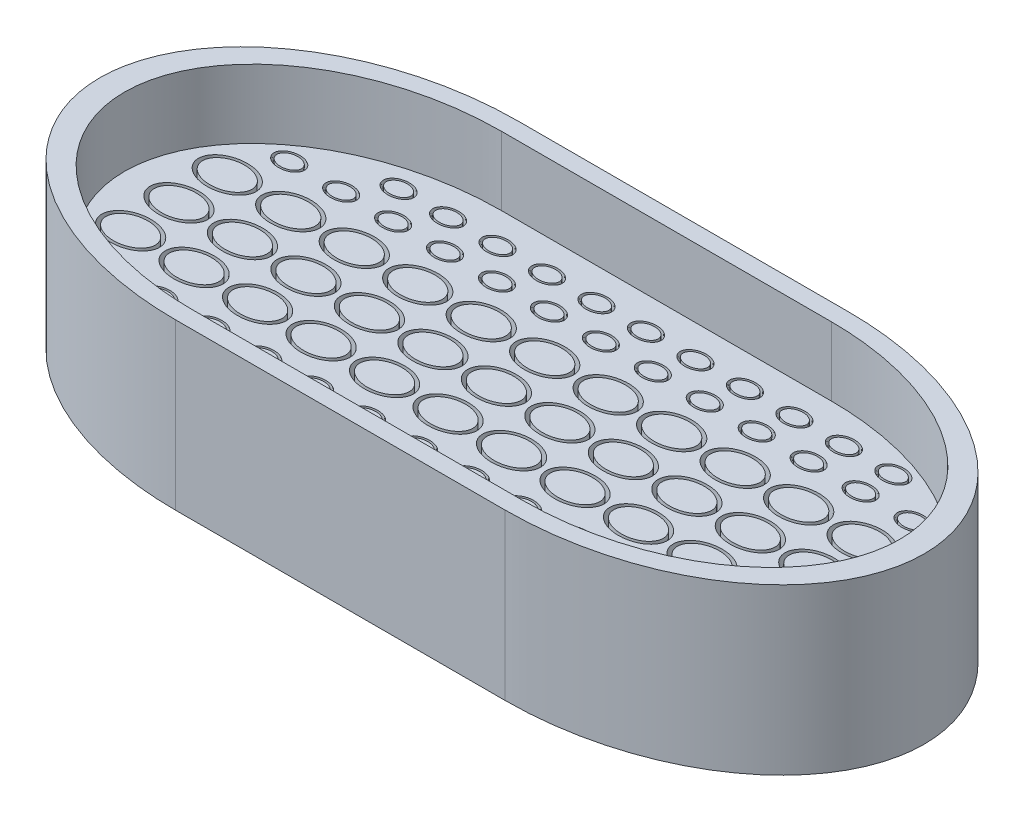
from build123d import *

# Parameters (mm, degrees)
BOSS_EXTRUDE1_DEPTH = 7
BOSS_EXTRUDE2_DEPTH = 12
SKETCH2_R           = 0.925
SKETCH2_R_2         = 0.75
SKETCH2_R_3         = 1.75
SKETCH2_R_4         = 1.5
CUT_EXTRUDE2_DEPTH  = 5
SCALE1_SCALE_X      = 1.2
SCALE1_SCALE_Y      = 1
SCALE1_SCALE_Z      = 0.833


with BuildPart() as part:
    # Sketch1 → Boss-Extrude1 (new body)
    with BuildSketch(Plane(origin=(0, 0, 0), x_dir=(1, 0, 0), z_dir=(0, 1, 0))):
        with BuildLine():
            Line((-10, 13.5), (10, 13.5))
            ThreePointArc((10, 13.5), (23.5, 0), (10, -13.5))
            Line((10, -13.5), (-10, -13.5))
            ThreePointArc((-10, -13.5), (-23.5, 0), (-10, 13.5))
        make_face()
    extrude(amount=BOSS_EXTRUDE1_DEPTH)

    # Sketch1<3> → Boss-Extrude2 (add)
    with BuildSketch(Plane(origin=(0, 0, 0), x_dir=(1, 0, 0), z_dir=(0, 1, 0))):
        with BuildLine():
            Line((-10, -15), (10, -15))
            ThreePointArc((10, -15), (25, 0), (10, 15))
            Line((10, 15), (-10, 15))
            ThreePointArc((-10, 15), (-25, 0), (-10, -15))
        make_face()
        with BuildLine():
            ThreePointArc((-10, 13.5), (-23.5, 0), (-10, -13.5))
            Line((-10, -13.5), (10, -13.5))
            ThreePointArc((10, -13.5), (23.5, 0), (10, 13.5))
            Line((10, 13.5), (-10, 13.5))
        make_face(mode=Mode.SUBTRACT)
    extrude(amount=BOSS_EXTRUDE2_DEPTH)

    # Sketch2 → Cut-Extrude2 (cut)
    # profile 1 of 81: a face of its own
    with BuildSketch(Plane(origin=(0, 7, 0), x_dir=(1, 0, 0), z_dir=(0, 1, 0))):
        with Locations(Location((18.777529996, -7.94251489, 0), (0, 0, 270))):
            Circle(SKETCH2_R)
        with Locations(Location((18.777529996, -7.94251489, 0), (0, 0, 270))):
            Circle(SKETCH2_R_2, mode=Mode.SUBTRACT)
    # profile 2 of 81: a face of its own
    with BuildSketch(Plane(origin=(0, 7, 0), x_dir=(1, 0, 0), z_dir=(0, 1, 0))):
        with Locations(Location((15.627529996, -7.94251489, 0), (0, 0, 270))):
            Circle(SKETCH2_R)
        with Locations(Location((15.627529996, -7.94251489, 0), (0, 0, 270))):
            Circle(SKETCH2_R_2, mode=Mode.SUBTRACT)
    # profile 3 of 81: a face of its own
    with BuildSketch(Plane(origin=(0, 7, 0), x_dir=(1, 0, 0), z_dir=(0, 1, 0))):
        with Locations(Location((18.30425361, -4.221261528, 0), (0, 0, 270))):
            Circle(SKETCH2_R_3)
        with Locations(Location((18.30425361, -4.221261528, 0), (0, 0, 270))):
            Circle(SKETCH2_R_4, mode=Mode.SUBTRACT)
    # profile 4 of 81: a face of its own
    with BuildSketch(Plane(origin=(0, 7, 0), x_dir=(1, 0, 0), z_dir=(0, 1, 0))):
        with Locations(Location((14.45425361, -4.221261528, 0), (0, 0, 270))):
            Circle(SKETCH2_R_3)
        with Locations(Location((14.45425361, -4.221261528, 0), (0, 0, 270))):
            Circle(SKETCH2_R_4, mode=Mode.SUBTRACT)
    # profile 5 of 81: a face of its own
    with BuildSketch(Plane(origin=(0, 7, 0), x_dir=(1, 0, 0), z_dir=(0, 1, 0))):
        with Locations(Location((12.477529996, -7.94251489, 0), (0, 0, 270))):
            Circle(SKETCH2_R)
        with Locations(Location((12.477529996, -7.94251489, 0), (0, 0, 270))):
            Circle(SKETCH2_R_2, mode=Mode.SUBTRACT)
    # profile 6 of 81: a face of its own
    with BuildSketch(Plane(origin=(0, 7, 0), x_dir=(1, 0, 0), z_dir=(0, 1, 0))):
        with Locations(Location((9.327529996, -7.94251489, 0), (0, 0, 270))):
            Circle(SKETCH2_R)
        with Locations(Location((9.327529996, -7.94251489, 0), (0, 0, 270))):
            Circle(SKETCH2_R_2, mode=Mode.SUBTRACT)
    # profile 7 of 81: a face of its own
    with BuildSketch(Plane(origin=(0, 7, 0), x_dir=(1, 0, 0), z_dir=(0, 1, 0))):
        with Locations(Location((10.60425361, -4.221261528, 0), (0, 0, 270))):
            Circle(SKETCH2_R_3)
        with Locations(Location((10.60425361, -4.221261528, 0), (0, 0, 270))):
            Circle(SKETCH2_R_4, mode=Mode.SUBTRACT)
    # profile 8 of 81: a face of its own
    with BuildSketch(Plane(origin=(0, 7, 0), x_dir=(1, 0, 0), z_dir=(0, 1, 0))):
        with Locations(Location((6.75425361, -4.221261528, 0), (0, 0, 270))):
            Circle(SKETCH2_R_3)
        with Locations(Location((6.75425361, -4.221261528, 0), (0, 0, 270))):
            Circle(SKETCH2_R_4, mode=Mode.SUBTRACT)
    # profile 9 of 81: a face of its own
    with BuildSketch(Plane(origin=(0, 7, 0), x_dir=(1, 0, 0), z_dir=(0, 1, 0))):
        with Locations(Location((6.177529996, -7.94251489, 0), (0, 0, 270))):
            Circle(SKETCH2_R)
        with Locations(Location((6.177529996, -7.94251489, 0), (0, 0, 270))):
            Circle(SKETCH2_R_2, mode=Mode.SUBTRACT)
    # profile 10 of 81: a face of its own
    with BuildSketch(Plane(origin=(0, 7, 0), x_dir=(1, 0, 0), z_dir=(0, 1, 0))):
        with Locations(Location((3.027529996, -7.94251489, 0), (0, 0, 270))):
            Circle(SKETCH2_R)
        with Locations(Location((3.027529996, -7.94251489, 0), (0, 0, 270))):
            Circle(SKETCH2_R_2, mode=Mode.SUBTRACT)
    # profile 11 of 81: a face of its own
    with BuildSketch(Plane(origin=(0, 7, 0), x_dir=(1, 0, 0), z_dir=(0, 1, 0))):
        with Locations(Location((2.90425361, -4.221261528, 0), (0, 0, 270))):
            Circle(SKETCH2_R_3)
        with Locations(Location((2.90425361, -4.221261528, 0), (0, 0, 270))):
            Circle(SKETCH2_R_4, mode=Mode.SUBTRACT)
    # profile 12 of 81: a face of its own
    with BuildSketch(Plane(origin=(0, 7, 0), x_dir=(1, 0, 0), z_dir=(0, 1, 0))):
        with Locations(Location((-0.122470004, -7.94251489, 0), (0, 0, 270))):
            Circle(SKETCH2_R)
        with Locations(Location((-0.122470004, -7.94251489, 0), (0, 0, 270))):
            Circle(SKETCH2_R_2, mode=Mode.SUBTRACT)
    # profile 13 of 81: a face of its own
    with BuildSketch(Plane(origin=(0, 7, 0), x_dir=(1, 0, 0), z_dir=(0, 1, 0))):
        with Locations(Location((-0.94574639, -4.221261528, 0), (0, 0, 270))):
            Circle(SKETCH2_R_3)
        with Locations(Location((-0.94574639, -4.221261528, 0), (0, 0, 270))):
            Circle(SKETCH2_R_4, mode=Mode.SUBTRACT)
    # profile 14 of 81: a face of its own
    with BuildSketch(Plane(origin=(0, 7, 0), x_dir=(1, 0, 0), z_dir=(0, 1, 0))):
        with Locations(Location((-3.272470004, -7.94251489, 0), (0, 0, 270))):
            Circle(SKETCH2_R)
        with Locations(Location((-3.272470004, -7.94251489, 0), (0, 0, 270))):
            Circle(SKETCH2_R_2, mode=Mode.SUBTRACT)
    # profile 15 of 81: a face of its own
    with BuildSketch(Plane(origin=(0, 7, 0), x_dir=(1, 0, 0), z_dir=(0, 1, 0))):
        with Locations(Location((-6.422470004, -7.94251489, 0), (0, 0, 270))):
            Circle(SKETCH2_R)
        with Locations(Location((-6.422470004, -7.94251489, 0), (0, 0, 270))):
            Circle(SKETCH2_R_2, mode=Mode.SUBTRACT)
    # profile 16 of 81: a face of its own
    with BuildSketch(Plane(origin=(0, 7, 0), x_dir=(1, 0, 0), z_dir=(0, 1, 0))):
        with Locations(Location((-4.79574639, -4.221261528, 0), (0, 0, 270))):
            Circle(SKETCH2_R_3)
        with Locations(Location((-4.79574639, -4.221261528, 0), (0, 0, 270))):
            Circle(SKETCH2_R_4, mode=Mode.SUBTRACT)
    # profile 17 of 81: a face of its own
    with BuildSketch(Plane(origin=(0, 7, 0), x_dir=(1, 0, 0), z_dir=(0, 1, 0))):
        with Locations(Location((-8.64574639, -4.221261528, 0), (0, 0, 270))):
            Circle(SKETCH2_R_3)
        with Locations(Location((-8.64574639, -4.221261528, 0), (0, 0, 270))):
            Circle(SKETCH2_R_4, mode=Mode.SUBTRACT)
    # profile 18 of 81: a face of its own
    with BuildSketch(Plane(origin=(0, 7, 0), x_dir=(1, 0, 0), z_dir=(0, 1, 0))):
        with Locations(Location((-9.572470004, -7.94251489, 0), (0, 0, 270))):
            Circle(SKETCH2_R)
        with Locations(Location((-9.572470004, -7.94251489, 0), (0, 0, 270))):
            Circle(SKETCH2_R_2, mode=Mode.SUBTRACT)
    # profile 19 of 81: a face of its own
    with BuildSketch(Plane(origin=(0, 7, 0), x_dir=(1, 0, 0), z_dir=(0, 1, 0))):
        with Locations(Location((-12.722470004, -7.94251489, 0), (0, 0, 270))):
            Circle(SKETCH2_R)
        with Locations(Location((-12.722470004, -7.94251489, 0), (0, 0, 270))):
            Circle(SKETCH2_R_2, mode=Mode.SUBTRACT)
    # profile 20 of 81: a face of its own
    with BuildSketch(Plane(origin=(0, 7, 0), x_dir=(1, 0, 0), z_dir=(0, 1, 0))):
        with Locations(Location((-12.49574639, -4.221261528, 0), (0, 0, 270))):
            Circle(SKETCH2_R_3)
        with Locations(Location((-12.49574639, -4.221261528, 0), (0, 0, 270))):
            Circle(SKETCH2_R_4, mode=Mode.SUBTRACT)
    # profile 21 of 81: a face of its own
    with BuildSketch(Plane(origin=(0, 7, 0), x_dir=(1, 0, 0), z_dir=(0, 1, 0))):
        with Locations(Location((-15.872470004, -7.94251489, 0), (0, 0, 270))):
            Circle(SKETCH2_R)
        with Locations(Location((-15.872470004, -7.94251489, 0), (0, 0, 270))):
            Circle(SKETCH2_R_2, mode=Mode.SUBTRACT)
    # profile 22 of 81: a face of its own
    with BuildSketch(Plane(origin=(0, 7, 0), x_dir=(1, 0, 0), z_dir=(0, 1, 0))):
        with Locations(Location((-16.34574639, -4.221261528, 0), (0, 0, 270))):
            Circle(SKETCH2_R_3)
        with Locations(Location((-16.34574639, -4.221261528, 0), (0, 0, 270))):
            Circle(SKETCH2_R_4, mode=Mode.SUBTRACT)
    # profile 23 of 81: a face of its own
    with BuildSketch(Plane(origin=(0, 7, 0), x_dir=(1, 0, 0), z_dir=(0, 1, 0))):
        with Locations(Location((-19.022470004, -7.94251489, 0), (0, 0, 270))):
            Circle(SKETCH2_R)
        with Locations(Location((-19.022470004, -7.94251489, 0), (0, 0, 270))):
            Circle(SKETCH2_R_2, mode=Mode.SUBTRACT)
    # profile 24 of 81: a face of its own
    with BuildSketch(Plane(origin=(0, 7, 0), x_dir=(1, 0, 0), z_dir=(0, 1, 0))):
        with Locations(Location((-20.19574639, -4.221261528, 0), (0, 0, 270))):
            Circle(SKETCH2_R_3)
        with Locations(Location((-20.19574639, -4.221261528, 0), (0, 0, 270))):
            Circle(SKETCH2_R_4, mode=Mode.SUBTRACT)
    # profile 25 of 81: a face of its own
    with BuildSketch(Plane(origin=(0, 7, 0), x_dir=(1, 0, 0), z_dir=(0, 1, 0))):
        with Locations(Location((-20.19574639, 4.221261528, 0), (0, 0, 270))):
            Circle(SKETCH2_R_3)
        with Locations(Location((-20.19574639, 4.221261528, 0), (0, 0, 270))):
            Circle(SKETCH2_R_4, mode=Mode.SUBTRACT)
    # profile 26 of 81: a face of its own
    with BuildSketch(Plane(origin=(0, 7, 0), x_dir=(1, 0, 0), z_dir=(0, 1, 0))):
        with Locations(Location((-16.34574639, 4.221261528, 0), (0, 0, 270))):
            Circle(SKETCH2_R_3)
        with Locations(Location((-16.34574639, 4.221261528, 0), (0, 0, 270))):
            Circle(SKETCH2_R_4, mode=Mode.SUBTRACT)
    # profile 27 of 81: a face of its own
    with BuildSketch(Plane(origin=(0, 7, 0), x_dir=(1, 0, 0), z_dir=(0, 1, 0))):
        with Locations(Location((-12.49574639, 4.221261528, 0), (0, 0, 270))):
            Circle(SKETCH2_R_3)
        with Locations(Location((-12.49574639, 4.221261528, 0), (0, 0, 270))):
            Circle(SKETCH2_R_4, mode=Mode.SUBTRACT)
    # profile 28 of 81: a face of its own
    with BuildSketch(Plane(origin=(0, 7, 0), x_dir=(1, 0, 0), z_dir=(0, 1, 0))):
        with Locations(Location((-8.64574639, 4.221261528, 0), (0, 0, 270))):
            Circle(SKETCH2_R_3)
        with Locations(Location((-8.64574639, 4.221261528, 0), (0, 0, 270))):
            Circle(SKETCH2_R_4, mode=Mode.SUBTRACT)
    # profile 29 of 81: a face of its own
    with BuildSketch(Plane(origin=(0, 7, 0), x_dir=(1, 0, 0), z_dir=(0, 1, 0))):
        with Locations(Location((-4.79574639, 4.221261528, 0), (0, 0, 270))):
            Circle(SKETCH2_R_3)
        with Locations(Location((-4.79574639, 4.221261528, 0), (0, 0, 270))):
            Circle(SKETCH2_R_4, mode=Mode.SUBTRACT)
    # profile 30 of 81: a face of its own
    with BuildSketch(Plane(origin=(0, 7, 0), x_dir=(1, 0, 0), z_dir=(0, 1, 0))):
        with Locations(Location((-0.94574639, 4.221261528, 0), (0, 0, 270))):
            Circle(SKETCH2_R_3)
        with Locations(Location((-0.94574639, 4.221261528, 0), (0, 0, 270))):
            Circle(SKETCH2_R_4, mode=Mode.SUBTRACT)
    # profile 31 of 81: a face of its own
    with BuildSketch(Plane(origin=(0, 7, 0), x_dir=(1, 0, 0), z_dir=(0, 1, 0))):
        with Locations(Location((2.90425361, 4.221261528, 0), (0, 0, 270))):
            Circle(SKETCH2_R_3)
        with Locations(Location((2.90425361, 4.221261528, 0), (0, 0, 270))):
            Circle(SKETCH2_R_4, mode=Mode.SUBTRACT)
    # profile 32 of 81: a face of its own
    with BuildSketch(Plane(origin=(0, 7, 0), x_dir=(1, 0, 0), z_dir=(0, 1, 0))):
        with Locations(Location((6.75425361, 4.221261528, 0), (0, 0, 270))):
            Circle(SKETCH2_R_3)
        with Locations(Location((6.75425361, 4.221261528, 0), (0, 0, 270))):
            Circle(SKETCH2_R_4, mode=Mode.SUBTRACT)
    # profile 33 of 81: a face of its own
    with BuildSketch(Plane(origin=(0, 7, 0), x_dir=(1, 0, 0), z_dir=(0, 1, 0))):
        with Locations(Location((10.60425361, 4.221261528, 0), (0, 0, 270))):
            Circle(SKETCH2_R_3)
        with Locations(Location((10.60425361, 4.221261528, 0), (0, 0, 270))):
            Circle(SKETCH2_R_4, mode=Mode.SUBTRACT)
    # profile 34 of 81: a face of its own
    with BuildSketch(Plane(origin=(0, 7, 0), x_dir=(1, 0, 0), z_dir=(0, 1, 0))):
        with Locations(Location((18.30425361, 4.221261528, 0), (0, 0, 270))):
            Circle(SKETCH2_R_3)
        with Locations(Location((18.30425361, 4.221261528, 0), (0, 0, 270))):
            Circle(SKETCH2_R_4, mode=Mode.SUBTRACT)
    # profile 35 of 81: a face of its own
    with BuildSketch(Plane(origin=(0, 7, 0), x_dir=(1, 0, 0), z_dir=(0, 1, 0))):
        with Locations(Location((14.45425361, 4.221261528, 0), (0, 0, 270))):
            Circle(SKETCH2_R_3)
        with Locations(Location((14.45425361, 4.221261528, 0), (0, 0, 270))):
            Circle(SKETCH2_R_4, mode=Mode.SUBTRACT)
    # profile 36 of 81: a face of its own
    with BuildSketch(Plane(origin=(0, 7, 0), x_dir=(1, 0, 0), z_dir=(0, 1, 0))):
        with Locations(Location((18.777529996, 7.94251489, 0), (0, 0, 270))):
            Circle(SKETCH2_R)
        with Locations(Location((18.777529996, 7.94251489, 0), (0, 0, 270))):
            Circle(SKETCH2_R_2, mode=Mode.SUBTRACT)
    # profile 37 of 81: a face of its own
    with BuildSketch(Plane(origin=(0, 7, 0), x_dir=(1, 0, 0), z_dir=(0, 1, 0))):
        with Locations(Location((15.627529996, 7.94251489, 0), (0, 0, 270))):
            Circle(SKETCH2_R)
        with Locations(Location((15.627529996, 7.94251489, 0), (0, 0, 270))):
            Circle(SKETCH2_R_2, mode=Mode.SUBTRACT)
    # profile 38 of 81: a face of its own
    with BuildSketch(Plane(origin=(0, 7, 0), x_dir=(1, 0, 0), z_dir=(0, 1, 0))):
        with Locations(Location((12.477529996, 7.94251489, 0), (0, 0, 270))):
            Circle(SKETCH2_R)
        with Locations(Location((12.477529996, 7.94251489, 0), (0, 0, 270))):
            Circle(SKETCH2_R_2, mode=Mode.SUBTRACT)
    # profile 39 of 81: a face of its own
    with BuildSketch(Plane(origin=(0, 7, 0), x_dir=(1, 0, 0), z_dir=(0, 1, 0))):
        with Locations(Location((9.327529996, 7.94251489, 0), (0, 0, 270))):
            Circle(SKETCH2_R)
        with Locations(Location((9.327529996, 7.94251489, 0), (0, 0, 270))):
            Circle(SKETCH2_R_2, mode=Mode.SUBTRACT)
    # profile 40 of 81: a face of its own
    with BuildSketch(Plane(origin=(0, 7, 0), x_dir=(1, 0, 0), z_dir=(0, 1, 0))):
        with Locations(Location((6.177529996, 7.94251489, 0), (0, 0, 270))):
            Circle(SKETCH2_R)
        with Locations(Location((6.177529996, 7.94251489, 0), (0, 0, 270))):
            Circle(SKETCH2_R_2, mode=Mode.SUBTRACT)
    # profile 41 of 81: a face of its own
    with BuildSketch(Plane(origin=(0, 7, 0), x_dir=(1, 0, 0), z_dir=(0, 1, 0))):
        with Locations(Location((3.027529996, 7.94251489, 0), (0, 0, 270))):
            Circle(SKETCH2_R)
        with Locations(Location((3.027529996, 7.94251489, 0), (0, 0, 270))):
            Circle(SKETCH2_R_2, mode=Mode.SUBTRACT)
    # profile 42 of 81: a face of its own
    with BuildSketch(Plane(origin=(0, 7, 0), x_dir=(1, 0, 0), z_dir=(0, 1, 0))):
        with Locations(Location((-0.122470004, 7.94251489, 0), (0, 0, 270))):
            Circle(SKETCH2_R)
        with Locations(Location((-0.122470004, 7.94251489, 0), (0, 0, 270))):
            Circle(SKETCH2_R_2, mode=Mode.SUBTRACT)
    # profile 43 of 81: a face of its own
    with BuildSketch(Plane(origin=(0, 7, 0), x_dir=(1, 0, 0), z_dir=(0, 1, 0))):
        with Locations(Location((-3.272470004, 7.94251489, 0), (0, 0, 270))):
            Circle(SKETCH2_R)
        with Locations(Location((-3.272470004, 7.94251489, 0), (0, 0, 270))):
            Circle(SKETCH2_R_2, mode=Mode.SUBTRACT)
    # profile 44 of 81: a face of its own
    with BuildSketch(Plane(origin=(0, 7, 0), x_dir=(1, 0, 0), z_dir=(0, 1, 0))):
        with Locations(Location((-6.422470004, 7.94251489, 0), (0, 0, 270))):
            Circle(SKETCH2_R)
        with Locations(Location((-6.422470004, 7.94251489, 0), (0, 0, 270))):
            Circle(SKETCH2_R_2, mode=Mode.SUBTRACT)
    # profile 45 of 81: a face of its own
    with BuildSketch(Plane(origin=(0, 7, 0), x_dir=(1, 0, 0), z_dir=(0, 1, 0))):
        with Locations(Location((-9.572470004, 7.94251489, 0), (0, 0, 270))):
            Circle(SKETCH2_R)
        with Locations(Location((-9.572470004, 7.94251489, 0), (0, 0, 270))):
            Circle(SKETCH2_R_2, mode=Mode.SUBTRACT)
    # profile 46 of 81: a face of its own
    with BuildSketch(Plane(origin=(0, 7, 0), x_dir=(1, 0, 0), z_dir=(0, 1, 0))):
        with Locations(Location((-12.722470004, 7.94251489, 0), (0, 0, 270))):
            Circle(SKETCH2_R)
        with Locations(Location((-12.722470004, 7.94251489, 0), (0, 0, 270))):
            Circle(SKETCH2_R_2, mode=Mode.SUBTRACT)
    # profile 47 of 81: a face of its own
    with BuildSketch(Plane(origin=(0, 7, 0), x_dir=(1, 0, 0), z_dir=(0, 1, 0))):
        with Locations(Location((-15.872470004, 7.94251489, 0), (0, 0, 270))):
            Circle(SKETCH2_R)
        with Locations(Location((-15.872470004, 7.94251489, 0), (0, 0, 270))):
            Circle(SKETCH2_R_2, mode=Mode.SUBTRACT)
    # profile 48 of 81: a face of its own
    with BuildSketch(Plane(origin=(0, 7, 0), x_dir=(1, 0, 0), z_dir=(0, 1, 0))):
        with Locations(Location((-19.022470004, 7.94251489, 0), (0, 0, 270))):
            Circle(SKETCH2_R)
        with Locations(Location((-19.022470004, 7.94251489, 0), (0, 0, 270))):
            Circle(SKETCH2_R_2, mode=Mode.SUBTRACT)
    # profile 49 of 81: a face of its own
    with BuildSketch(Plane(origin=(0, 7, 0), x_dir=(1, 0, 0), z_dir=(0, 1, 0))):
        with Locations(Location((-20.19574639, 0, 0), (0, 0, 270))):
            Circle(SKETCH2_R_3)
        with Locations(Location((-20.19574639, 0, 0), (0, 0, 270))):
            Circle(SKETCH2_R_4, mode=Mode.SUBTRACT)
    # profile 50 of 81: a face of its own
    with BuildSketch(Plane(origin=(0, 7, 0), x_dir=(1, 0, 0), z_dir=(0, 1, 0))):
        with Locations(Location((-16.34574639, 0, 0), (0, 0, 270))):
            Circle(SKETCH2_R_3)
        with Locations(Location((-16.34574639, 0, 0), (0, 0, 270))):
            Circle(SKETCH2_R_4, mode=Mode.SUBTRACT)
    # profile 51 of 81: a face of its own
    with BuildSketch(Plane(origin=(0, 7, 0), x_dir=(1, 0, 0), z_dir=(0, 1, 0))):
        with Locations(Location((-12.49574639, 0, 0), (0, 0, 270))):
            Circle(SKETCH2_R_3)
        with Locations(Location((-12.49574639, 0, 0), (0, 0, 270))):
            Circle(SKETCH2_R_4, mode=Mode.SUBTRACT)
    # profile 52 of 81: a face of its own
    with BuildSketch(Plane(origin=(0, 7, 0), x_dir=(1, 0, 0), z_dir=(0, 1, 0))):
        with Locations(Location((-8.64574639, 0, 0), (0, 0, 270))):
            Circle(SKETCH2_R_3)
        with Locations(Location((-8.64574639, 0, 0), (0, 0, 270))):
            Circle(SKETCH2_R_4, mode=Mode.SUBTRACT)
    # profile 53 of 81: a face of its own
    with BuildSketch(Plane(origin=(0, 7, 0), x_dir=(1, 0, 0), z_dir=(0, 1, 0))):
        with Locations(Location((-4.79574639, 0, 0), (0, 0, 270))):
            Circle(SKETCH2_R_3)
        with Locations(Location((-4.79574639, 0, 0), (0, 0, 270))):
            Circle(SKETCH2_R_4, mode=Mode.SUBTRACT)
    # profile 54 of 81: a face of its own
    with BuildSketch(Plane(origin=(0, 7, 0), x_dir=(1, 0, 0), z_dir=(0, 1, 0))):
        with Locations(Location((-0.94574639, 0, 0), (0, 0, 270))):
            Circle(SKETCH2_R_3)
        with Locations(Location((-0.94574639, 0, 0), (0, 0, 270))):
            Circle(SKETCH2_R_4, mode=Mode.SUBTRACT)
    # profile 55 of 81: a face of its own
    with BuildSketch(Plane(origin=(0, 7, 0), x_dir=(1, 0, 0), z_dir=(0, 1, 0))):
        with Locations(Location((2.90425361, 0, 0), (0, 0, 270))):
            Circle(SKETCH2_R_3)
        with Locations(Location((2.90425361, 0, 0), (0, 0, 270))):
            Circle(SKETCH2_R_4, mode=Mode.SUBTRACT)
    # profile 56 of 81: a face of its own
    with BuildSketch(Plane(origin=(0, 7, 0), x_dir=(1, 0, 0), z_dir=(0, 1, 0))):
        with Locations(Location((6.75425361, 0, 0), (0, 0, 270))):
            Circle(SKETCH2_R_3)
        with Locations(Location((6.75425361, 0, 0), (0, 0, 270))):
            Circle(SKETCH2_R_4, mode=Mode.SUBTRACT)
    # profile 57 of 81: a face of its own
    with BuildSketch(Plane(origin=(0, 7, 0), x_dir=(1, 0, 0), z_dir=(0, 1, 0))):
        with Locations(Location((10.60425361, 0, 0), (0, 0, 270))):
            Circle(SKETCH2_R_3)
        with Locations(Location((10.60425361, 0, 0), (0, 0, 270))):
            Circle(SKETCH2_R_4, mode=Mode.SUBTRACT)
    # profile 58 of 81: a face of its own
    with BuildSketch(Plane(origin=(0, 7, 0), x_dir=(1, 0, 0), z_dir=(0, 1, 0))):
        with Locations(Location((14.45425361, 0, 0), (0, 0, 270))):
            Circle(SKETCH2_R_3)
        with Locations(Location((14.45425361, 0, 0), (0, 0, 270))):
            Circle(SKETCH2_R_4, mode=Mode.SUBTRACT)
    # profile 59 of 81: a face of its own
    with BuildSketch(Plane(origin=(0, 7, 0), x_dir=(1, 0, 0), z_dir=(0, 1, 0))):
        with Locations(Location((18.30425361, 0, 0), (0, 0, 270))):
            Circle(SKETCH2_R_3)
        with Locations(Location((18.30425361, 0, 0), (0, 0, 270))):
            Circle(SKETCH2_R_4, mode=Mode.SUBTRACT)
    # profile 60 of 81: a face of its own
    with BuildSketch(Plane(origin=(0, 7, 0), x_dir=(1, 0, 0), z_dir=(0, 1, 0))):
        with Locations(Location((15.729416924, 10.654295984, 0), (0, 0, 270))):
            Circle(SKETCH2_R)
        with Locations(Location((15.729416924, 10.654295984, 0), (0, 0, 270))):
            Circle(SKETCH2_R_2, mode=Mode.SUBTRACT)
    # profile 61 of 81: a face of its own
    with BuildSketch(Plane(origin=(0, 7, 0), x_dir=(1, 0, 0), z_dir=(0, 1, 0))):
        with Locations(Location((12.729416924, 10.654295984, 0), (0, 0, 270))):
            Circle(SKETCH2_R)
        with Locations(Location((12.729416924, 10.654295984, 0), (0, 0, 270))):
            Circle(SKETCH2_R_2, mode=Mode.SUBTRACT)
    # profile 62 of 81: a face of its own
    with BuildSketch(Plane(origin=(0, 7, 0), x_dir=(1, 0, 0), z_dir=(0, 1, 0))):
        with Locations(Location((9.729416924, 10.654295984, 0), (0, 0, 270))):
            Circle(SKETCH2_R)
        with Locations(Location((9.729416924, 10.654295984, 0), (0, 0, 270))):
            Circle(SKETCH2_R_2, mode=Mode.SUBTRACT)
    # profile 63 of 81: a face of its own
    with BuildSketch(Plane(origin=(0, 7, 0), x_dir=(1, 0, 0), z_dir=(0, 1, 0))):
        with Locations(Location((6.729416924, 10.654295984, 0), (0, 0, 270))):
            Circle(SKETCH2_R)
        with Locations(Location((6.729416924, 10.654295984, 0), (0, 0, 270))):
            Circle(SKETCH2_R_2, mode=Mode.SUBTRACT)
    # profile 64 of 81: a face of its own
    with BuildSketch(Plane(origin=(0, 7, 0), x_dir=(1, 0, 0), z_dir=(0, 1, 0))):
        with Locations(Location((3.729416924, 10.654295984, 0), (0, 0, 270))):
            Circle(SKETCH2_R)
        with Locations(Location((3.729416924, 10.654295984, 0), (0, 0, 270))):
            Circle(SKETCH2_R_2, mode=Mode.SUBTRACT)
    # profile 65 of 81: a face of its own
    with BuildSketch(Plane(origin=(0, 7, 0), x_dir=(1, 0, 0), z_dir=(0, 1, 0))):
        with Locations(Location((0.729416924, 10.654295984, 0), (0, 0, 270))):
            Circle(SKETCH2_R)
        with Locations(Location((0.729416924, 10.654295984, 0), (0, 0, 270))):
            Circle(SKETCH2_R_2, mode=Mode.SUBTRACT)
    # profile 66 of 81: a face of its own
    with BuildSketch(Plane(origin=(0, 7, 0), x_dir=(1, 0, 0), z_dir=(0, 1, 0))):
        with Locations(Location((-2.270583076, 10.654295984, 0), (0, 0, 270))):
            Circle(SKETCH2_R)
        with Locations(Location((-2.270583076, 10.654295984, 0), (0, 0, 270))):
            Circle(SKETCH2_R_2, mode=Mode.SUBTRACT)
    # profile 67 of 81: a face of its own
    with BuildSketch(Plane(origin=(0, 7, 0), x_dir=(1, 0, 0), z_dir=(0, 1, 0))):
        with Locations(Location((-5.270583076, 10.654295984, 0), (0, 0, 270))):
            Circle(SKETCH2_R)
        with Locations(Location((-5.270583076, 10.654295984, 0), (0, 0, 270))):
            Circle(SKETCH2_R_2, mode=Mode.SUBTRACT)
    # profile 68 of 81: a face of its own
    with BuildSketch(Plane(origin=(0, 7, 0), x_dir=(1, 0, 0), z_dir=(0, 1, 0))):
        with Locations(Location((-8.270583076, 10.654295984, 0), (0, 0, 270))):
            Circle(SKETCH2_R)
        with Locations(Location((-8.270583076, 10.654295984, 0), (0, 0, 270))):
            Circle(SKETCH2_R_2, mode=Mode.SUBTRACT)
    # profile 69 of 81: a face of its own
    with BuildSketch(Plane(origin=(0, 7, 0), x_dir=(1, 0, 0), z_dir=(0, 1, 0))):
        with Locations(Location((-14.270583076, 10.654295984, 0), (0, 0, 270))):
            Circle(SKETCH2_R)
        with Locations(Location((-14.270583076, 10.654295984, 0), (0, 0, 270))):
            Circle(SKETCH2_R_2, mode=Mode.SUBTRACT)
    # profile 70 of 81: a face of its own
    with BuildSketch(Plane(origin=(0, 7, 0), x_dir=(1, 0, 0), z_dir=(0, 1, 0))):
        with Locations(Location((-11.270583076, 10.654295984, 0), (0, 0, 270))):
            Circle(SKETCH2_R)
        with Locations(Location((-11.270583076, 10.654295984, 0), (0, 0, 270))):
            Circle(SKETCH2_R_2, mode=Mode.SUBTRACT)
    # profile 71 of 81: a face of its own
    with BuildSketch(Plane(origin=(0, 7, 0), x_dir=(1, 0, 0), z_dir=(0, 1, 0))):
        with Locations(Location((-14.270583076, -10.654295984, 0), (0, 0, 270))):
            Circle(SKETCH2_R)
        with Locations(Location((-14.270583076, -10.654295984, 0), (0, 0, 270))):
            Circle(SKETCH2_R_2, mode=Mode.SUBTRACT)
    # profile 72 of 81: a face of its own
    with BuildSketch(Plane(origin=(0, 7, 0), x_dir=(1, 0, 0), z_dir=(0, 1, 0))):
        with Locations(Location((-11.270583076, -10.654295984, 0), (0, 0, 270))):
            Circle(SKETCH2_R)
        with Locations(Location((-11.270583076, -10.654295984, 0), (0, 0, 270))):
            Circle(SKETCH2_R_2, mode=Mode.SUBTRACT)
    # profile 73 of 81: a face of its own
    with BuildSketch(Plane(origin=(0, 7, 0), x_dir=(1, 0, 0), z_dir=(0, 1, 0))):
        with Locations(Location((-8.270583076, -10.654295984, 0), (0, 0, 270))):
            Circle(SKETCH2_R)
        with Locations(Location((-8.270583076, -10.654295984, 0), (0, 0, 270))):
            Circle(SKETCH2_R_2, mode=Mode.SUBTRACT)
    # profile 74 of 81: a face of its own
    with BuildSketch(Plane(origin=(0, 7, 0), x_dir=(1, 0, 0), z_dir=(0, 1, 0))):
        with Locations(Location((-5.270583076, -10.654295984, 0), (0, 0, 270))):
            Circle(SKETCH2_R)
        with Locations(Location((-5.270583076, -10.654295984, 0), (0, 0, 270))):
            Circle(SKETCH2_R_2, mode=Mode.SUBTRACT)
    # profile 75 of 81: a face of its own
    with BuildSketch(Plane(origin=(0, 7, 0), x_dir=(1, 0, 0), z_dir=(0, 1, 0))):
        with Locations(Location((-2.270583076, -10.654295984, 0), (0, 0, 270))):
            Circle(SKETCH2_R)
        with Locations(Location((-2.270583076, -10.654295984, 0), (0, 0, 270))):
            Circle(SKETCH2_R_2, mode=Mode.SUBTRACT)
    # profile 76 of 81: a face of its own
    with BuildSketch(Plane(origin=(0, 7, 0), x_dir=(1, 0, 0), z_dir=(0, 1, 0))):
        with Locations(Location((0.729416924, -10.654295984, 0), (0, 0, 270))):
            Circle(SKETCH2_R)
        with Locations(Location((0.729416924, -10.654295984, 0), (0, 0, 270))):
            Circle(SKETCH2_R_2, mode=Mode.SUBTRACT)
    # profile 77 of 81: a face of its own
    with BuildSketch(Plane(origin=(0, 7, 0), x_dir=(1, 0, 0), z_dir=(0, 1, 0))):
        with Locations(Location((3.729416924, -10.654295984, 0), (0, 0, 270))):
            Circle(SKETCH2_R)
        with Locations(Location((3.729416924, -10.654295984, 0), (0, 0, 270))):
            Circle(SKETCH2_R_2, mode=Mode.SUBTRACT)
    # profile 78 of 81: a face of its own
    with BuildSketch(Plane(origin=(0, 7, 0), x_dir=(1, 0, 0), z_dir=(0, 1, 0))):
        with Locations(Location((6.729416924, -10.654295984, 0), (0, 0, 270))):
            Circle(SKETCH2_R)
        with Locations(Location((6.729416924, -10.654295984, 0), (0, 0, 270))):
            Circle(SKETCH2_R_2, mode=Mode.SUBTRACT)
    # profile 79 of 81: a face of its own
    with BuildSketch(Plane(origin=(0, 7, 0), x_dir=(1, 0, 0), z_dir=(0, 1, 0))):
        with Locations(Location((9.729416924, -10.654295984, 0), (0, 0, 270))):
            Circle(SKETCH2_R)
        with Locations(Location((9.729416924, -10.654295984, 0), (0, 0, 270))):
            Circle(SKETCH2_R_2, mode=Mode.SUBTRACT)
    # profile 80 of 81: a face of its own
    with BuildSketch(Plane(origin=(0, 7, 0), x_dir=(1, 0, 0), z_dir=(0, 1, 0))):
        with Locations(Location((12.729416924, -10.654295984, 0), (0, 0, 270))):
            Circle(SKETCH2_R)
        with Locations(Location((12.729416924, -10.654295984, 0), (0, 0, 270))):
            Circle(SKETCH2_R_2, mode=Mode.SUBTRACT)
    # profile 81 of 81: a face of its own
    with BuildSketch(Plane(origin=(0, 7, 0), x_dir=(1, 0, 0), z_dir=(0, 1, 0))):
        with Locations(Location((15.729416924, -10.654295984, 0), (0, 0, 270))):
            Circle(SKETCH2_R)
        with Locations(Location((15.729416924, -10.654295984, 0), (0, 0, 270))):
            Circle(SKETCH2_R_2, mode=Mode.SUBTRACT)
    extrude(amount=-CUT_EXTRUDE2_DEPTH, mode=Mode.SUBTRACT)


with BuildPart() as part_1:
    # Scale1: scaled about (0, 0, 0)
    add(part.part.scale((SCALE1_SCALE_X, SCALE1_SCALE_Y, SCALE1_SCALE_Z), about=(0, 0, 0)))


solid = part_1.part
